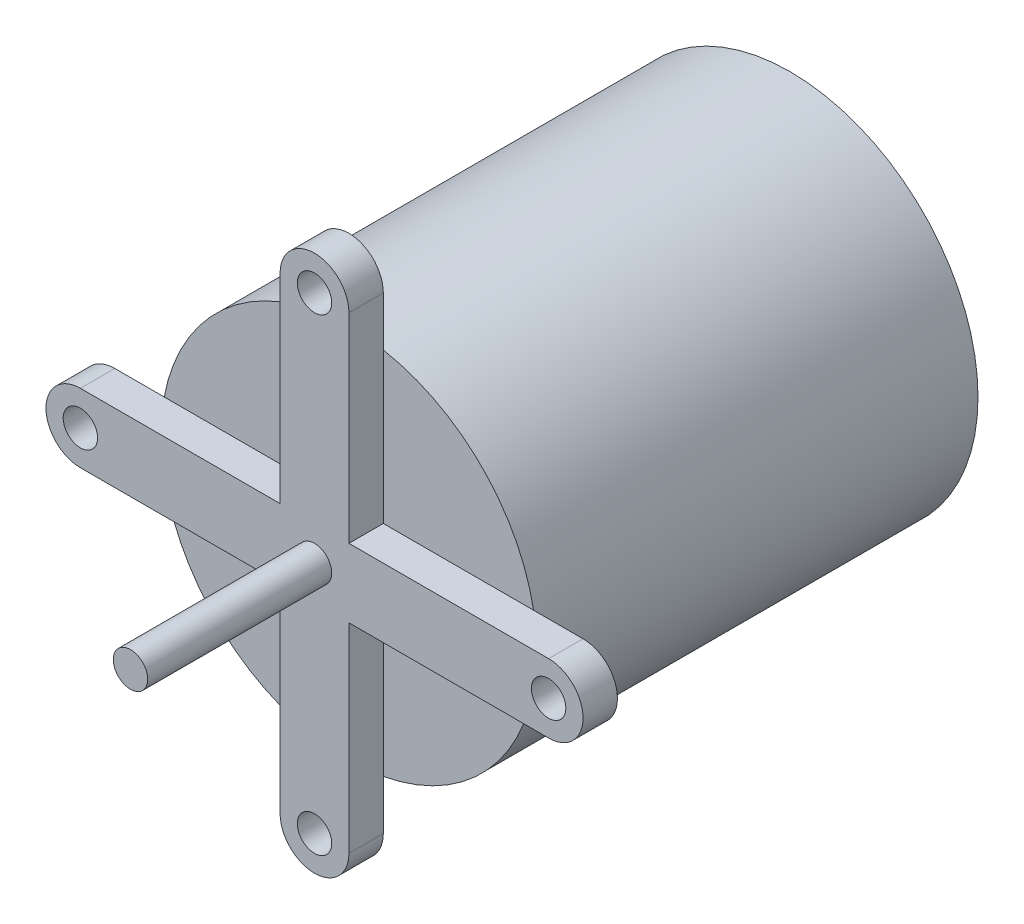
from build123d import *

# Parameters (mm, degrees)
SKETCH1_R           = 10.922
BOSS_EXTRUDE1_DEPTH = 25.654
SKETCH2_R           = 1.00000054
BOSS_EXTRUDE4_DEPTH = 2.00000108
SKETCH3_R           = 1.00000054
BOSS_EXTRUDE3_DEPTH = 12.7


with BuildPart() as part:
    # Sketch1 → Boss-Extrude1 (new body)
    with BuildSketch(Plane.XY):
        Circle(SKETCH1_R)
    extrude(amount=BOSS_EXTRUDE1_DEPTH)

    # Sketch2 → Boss-Extrude4 (add)
    # profile 1 of 7: a face of its own
    with BuildSketch(Plane.XY.offset(25.654)):
        with BuildLine():
            Line((-1.999996, 10.737322758), (-1.999996, 1.999996))
            Line((-1.999996, 1.999996), (1.999996, 1.999996))
            Line((1.999996, 1.999996), (1.999996, 10.737322758))
            ThreePointArc((1.999996, 10.737322758), (0, 10.922), (-1.999996, 10.737322758))
        make_face()
    # profile 2 of 7: a face of its own
    with BuildSketch(Plane.XY.offset(25.654)):
        with BuildLine():
            Line((-1.999996, 13.6118), (-1.999996, 10.737322758))
            ThreePointArc((-1.999996, 10.737322758), (0, 10.922), (1.999996, 10.737322758))
            Line((1.999996, 10.737322758), (1.999996, 13.6118))
            ThreePointArc((1.999996, 13.6118), (0, 15.611796), (-1.999996, 13.6118))
        make_face()
        with Locations((0, 13.6118)):
            Circle(SKETCH2_R, mode=Mode.SUBTRACT)
    # profile 3 of 7: a face of its own
    with BuildSketch(Plane.XY.offset(25.654)):
        with BuildLine():
            ThreePointArc((-10.737322758, 1.999996), (-10.922, 0), (-10.737322758, -1.999996))
            Line((-10.737322758, -1.999996), (-1.999996, -1.999996))
            Line((-1.999996, -1.999996), (-1.999996, -10.737322758))
            ThreePointArc((-1.999996, -10.737322758), (0, -10.922), (1.999996, -10.737322758))
            Line((1.999996, -10.737322758), (1.999996, -1.999996))
            Line((1.999996, -1.999996), (10.737322758, -1.999996))
            ThreePointArc((10.737322758, -1.999996), (10.875732692, -1.00425217), (10.922, 0))
            ThreePointArc((10.922, 0), (10.875732692, 1.00425217), (10.737322758, 1.999996))
            Line((10.737322758, 1.999996), (1.999996, 1.999996))
            Line((1.999996, 1.999996), (0, 0))
            Line((0, 0), (-1.999996, 1.999996))
            Line((-1.999996, 1.999996), (-10.737322758, 1.999996))
        make_face()
    # profile 4 of 7: a face of its own
    with BuildSketch(Plane.XY.offset(25.654)):
        with BuildLine():
            ThreePointArc((10.922, 0), (10.875732692, -1.00425217), (10.737322758, -1.999996))
            Line((10.737322758, -1.999996), (13.6118, -1.999996))
            ThreePointArc((13.6118, -1.999996), (15.611796, 0), (13.6118, 1.999996))
            Line((13.6118, 1.999996), (10.737322758, 1.999996))
            ThreePointArc((10.737322758, 1.999996), (10.875732692, 1.00425217), (10.922, 0))
        make_face()
        with Locations((13.6118, 0)):
            Circle(SKETCH2_R, mode=Mode.SUBTRACT)
    # profile 5 of 7: a face of its own
    with BuildSketch(Plane.XY.offset(25.654)):
        Polygon((1.999996, 1.999996), (-1.999996, 1.999996), (0, 0), align=None)
    # profile 6 of 7: a face of its own
    with BuildSketch(Plane.XY.offset(25.654)):
        with BuildLine():
            ThreePointArc((1.999996, -10.737322758), (0, -10.922), (-1.999996, -10.737322758))
            Line((-1.999996, -10.737322758), (-1.999996, -13.6118))
            ThreePointArc((-1.999996, -13.6118), (0, -15.611796), (1.999996, -13.6118))
            Line((1.999996, -13.6118), (1.999996, -10.737322758))
        make_face()
        with Locations((0, -13.6118)):
            Circle(SKETCH2_R, mode=Mode.SUBTRACT)
    # profile 7 of 7: a face of its own
    with BuildSketch(Plane.XY.offset(25.654)):
        with BuildLine():
            ThreePointArc((-13.6118, 1.999996), (-15.611796, 0), (-13.6118, -1.999996))
            Line((-13.6118, -1.999996), (-10.737322758, -1.999996))
            ThreePointArc((-10.737322758, -1.999996), (-10.922, 0), (-10.737322758, 1.999996))
            Line((-10.737322758, 1.999996), (-13.6118, 1.999996))
        make_face()
        with Locations((-13.6118, 0)):
            Circle(SKETCH2_R, mode=Mode.SUBTRACT)
    extrude(amount=BOSS_EXTRUDE4_DEPTH)

    # Sketch3 → Boss-Extrude3 (add)
    with BuildSketch(Plane.XY.offset(25.654)):
        Circle(SKETCH3_R)
    extrude(amount=BOSS_EXTRUDE3_DEPTH)


solid = part.part
